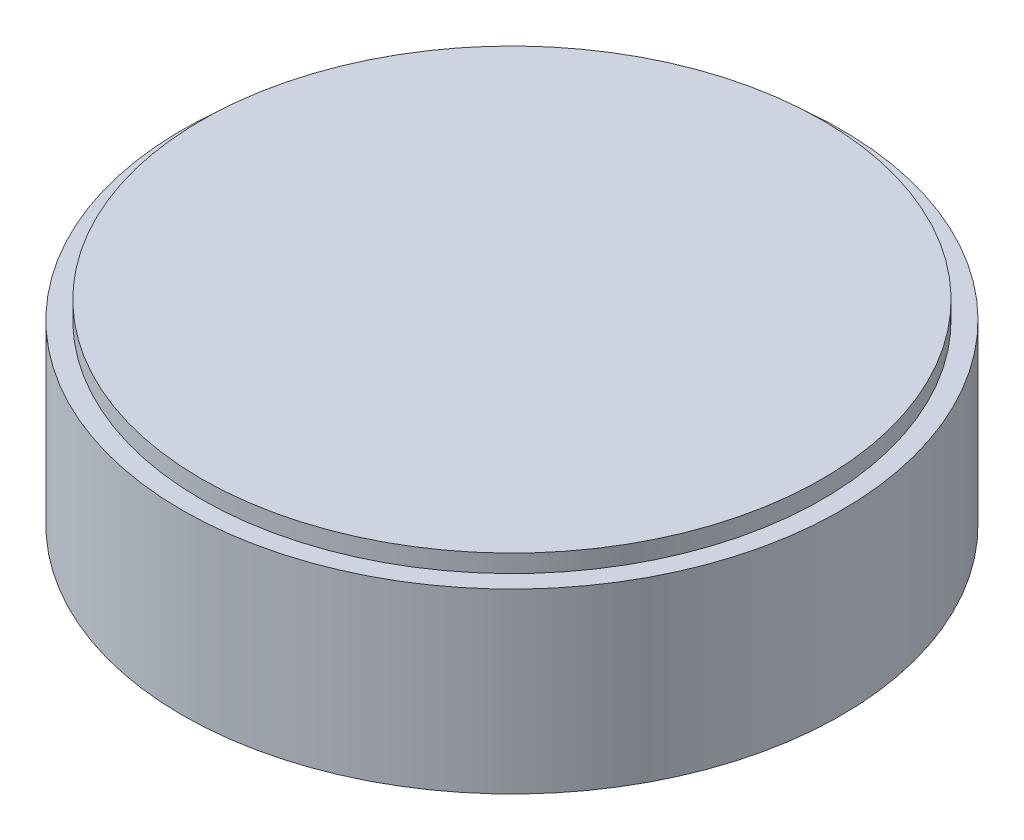
from build123d import *

# Parameters (mm, degrees)
SKETCH1_R           = 18.572821533
SKETCH1_R_2         = 17.5
BOSS_EXTRUDE1_DEPTH = 10
SKETCH2_R           = 17.5
BOSS_EXTRUDE2_DEPTH = 1


with BuildPart() as part:
    # Sketch1 → Boss-Extrude1 (new body)
    with BuildSketch(Plane(origin=(0, 0, 0), x_dir=(1, 0, 0), z_dir=(0, 1, 0))):
        with Locations(Location((-8.055550378, 10.740733837, 0), (0, 0, 270))):
            Circle(SKETCH1_R)
        with Locations(Location((-8.055550378, 10.740733837, 0), (0, 0, 270))):
            Circle(SKETCH1_R_2, mode=Mode.SUBTRACT)
    extrude(amount=BOSS_EXTRUDE1_DEPTH)


with BuildPart() as body_2:
    # Sketch2 → Boss-Extrude2 (new body)
    with BuildSketch(Plane(origin=(0, 10, 0), x_dir=(1, 0, 0), z_dir=(0, 1, 0))):
        with Locations(Location((-8.055550378, 10.740733837, 0), (0, 0, 270))):
            Circle(SKETCH2_R)
    extrude(amount=BOSS_EXTRUDE2_DEPTH)


solid = Compound([part.part, body_2.part])
